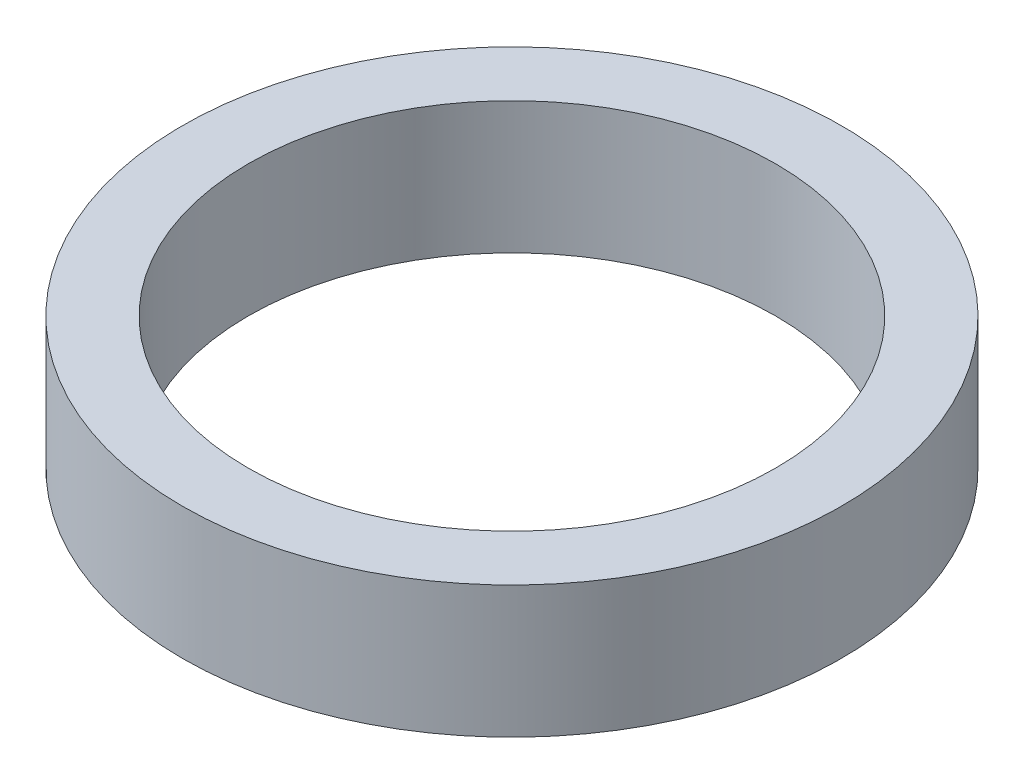
from build123d import *

# Parameters (mm, degrees)
SKETCH1_W = 50
SKETCH1_H = 100


with BuildPart() as part:
    # Sketch1 → Revolve1 (revolve)
    with BuildSketch(Plane(origin=(0, 0, 0), x_dir=(0, 0, -1), z_dir=(1, 0, 0))):
        with Locations((-225, 0)):
            Rectangle(SKETCH1_W, SKETCH1_H)
    revolve(axis=Axis((0, 174.427480916, 0), (0, -1, 0)))


solid = part.part
